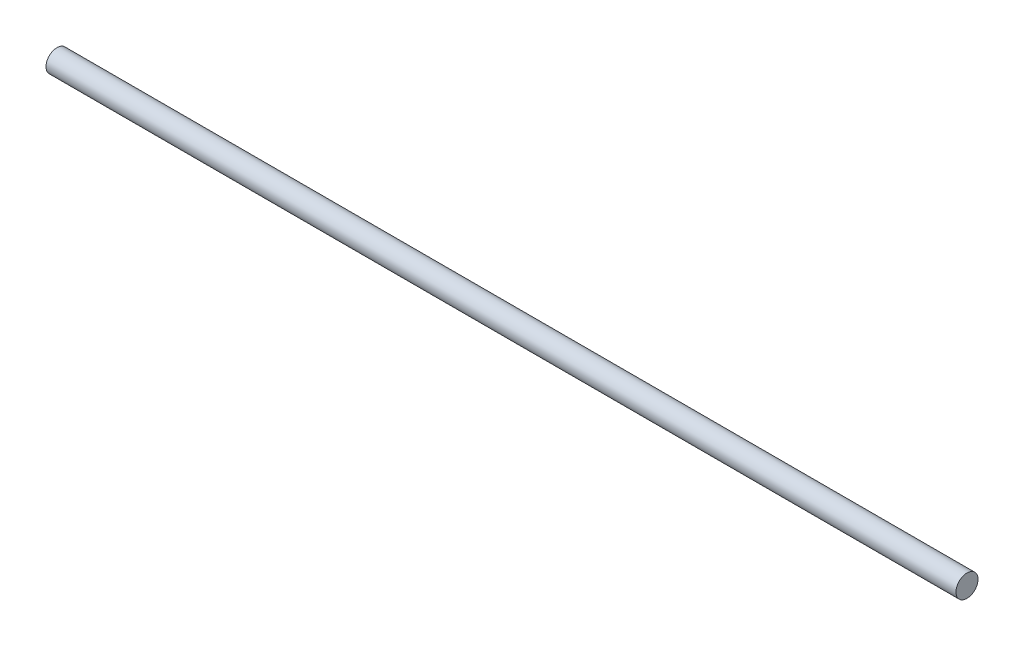
from build123d import *

# Parameters (mm, degrees)
SKETCH1_R           = 4
BOSS_EXTRUDE2_DEPTH = 330


with BuildPart() as part:
    # Sketch1 → Boss-Extrude2 (new body)
    with BuildSketch(Plane(origin=(34.805238637, 0, 0), x_dir=(0, 0, -1), z_dir=(1, 0, 0))):
        with Locations(Location((-18.444896481, -14.019347406, 0), (0, 0, 90))):
            Circle(SKETCH1_R)
    extrude(amount=BOSS_EXTRUDE2_DEPTH)


solid = part.part
